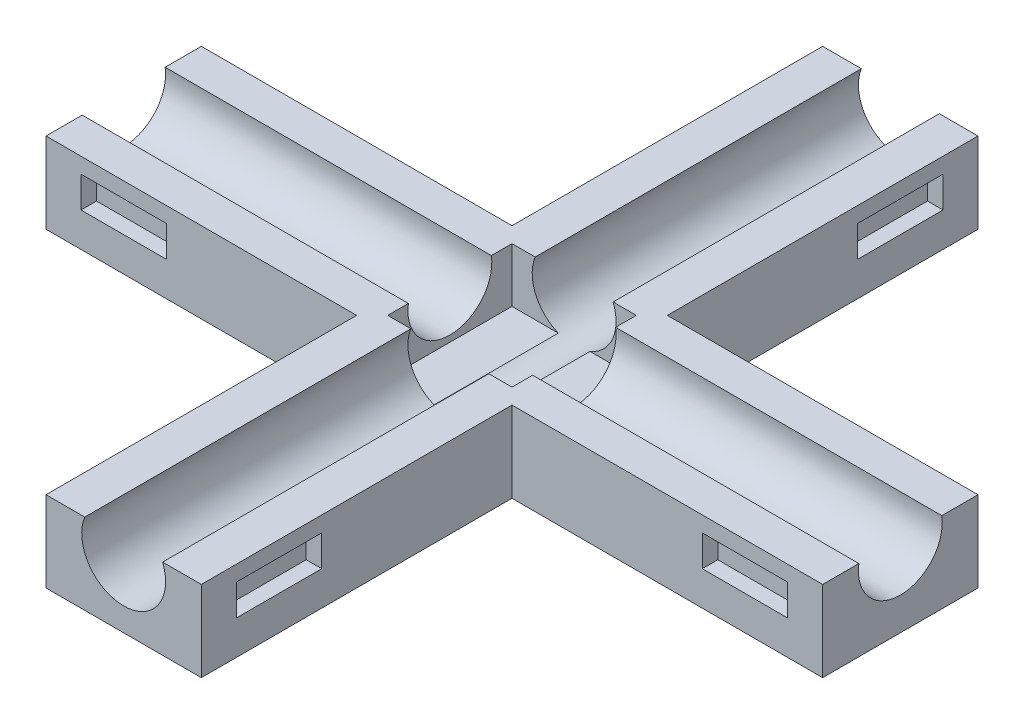
from build123d import *

# Parameters (mm, degrees)
BOSS_EXTRUDE5_DEPTH         = 5.2
CUT_EXTRUDE1_REACH          = 58.143
SKETCH4_R                   = 2.7
SKETCH5_R                   = 2.7
CUT_EXTRUDE2_DEPTH          = 57.143031625
SKETCH6_W                   = 8
SKETCH6_H                   = 8
CUT_EXTRUDE3_DEPTH          = 3.5
SKETCH7_W                   = 5.5
SKETCH7_H                   = 2
CUT_EXTRUDE4_DEPTH          = 1
CIRPATTERN1_COPY_1_SKETCH_W = 5.5
CIRPATTERN1_COPY_1_SKETCH_H = 2
CIRPATTERN1_COPY_1_DEPTH    = 1
CIRPATTERN1_COPY_2_SKETCH_W = 5.5
CIRPATTERN1_COPY_2_SKETCH_H = 2
CIRPATTERN1_COPY_2_DEPTH    = 1
CIRPATTERN1_COPY_3_SKETCH_W = 5.5
CIRPATTERN1_COPY_3_SKETCH_H = 2
CIRPATTERN1_COPY_3_DEPTH    = 1
CIRPATTERN1_COPY_4_SKETCH_W = 5.5
CIRPATTERN1_COPY_4_SKETCH_H = 2
CIRPATTERN1_COPY_4_DEPTH    = 1
CIRPATTERN1_COPY_5_SKETCH_W = 5.5
CIRPATTERN1_COPY_5_SKETCH_H = 2
CIRPATTERN1_COPY_5_DEPTH    = 1
CIRPATTERN1_COPY_6_SKETCH_W = 5.5
CIRPATTERN1_COPY_6_SKETCH_H = 2
CIRPATTERN1_COPY_6_DEPTH    = 1


with BuildPart() as part:
    # Sketch3 → Boss-Extrude5 (new body)
    with BuildSketch(Plane(origin=(0, 0, 0), x_dir=(1, 0, 0), z_dir=(0, 1, 0))):
        Polygon((5, 5), (25, 5), (25, -5), (5, -5), (5, -25), (-5, -25), (-5, -5), (-25, -5), (-25, 5), (-5, 5), (-5, 25), (5, 25), align=None)
    extrude(amount=BOSS_EXTRUDE5_DEPTH)

    # Sketch4 → Cut-Extrude1 (cut, up to next)
    with BuildSketch(Plane.XY.offset(25), mode=Mode.PRIVATE) as cut_extrude1_sk1:
        with Locations((0, 4.2)):
            Circle(SKETCH4_R)
    cut_extrude1_tool1 = extrude(cut_extrude1_sk1.sketch, amount=-CUT_EXTRUDE1_REACH, mode=Mode.PRIVATE) & part.part
    add(cut_extrude1_tool1.solids().sort_by_distance((0, 4.2, 25))[0], mode=Mode.SUBTRACT)

    # Sketch5 → Cut-Extrude2 (cut, through all)
    with BuildSketch(Plane(origin=(25, 0, 0), x_dir=(0, 0, -1), z_dir=(1, 0, 0))):
        with Locations((0, 4.8)):
            Circle(SKETCH5_R)
    extrude(amount=-CUT_EXTRUDE2_DEPTH, mode=Mode.SUBTRACT)

    # Sketch6 → Cut-Extrude3 (cut)
    with BuildSketch(Plane(origin=(0, 5.2, 0), x_dir=(1, 0, 0), z_dir=(0, 1, 0))):
        Rectangle(SKETCH6_W, SKETCH6_H)
    extrude(amount=-CUT_EXTRUDE3_DEPTH, mode=Mode.SUBTRACT)

    # Sketch7 → Cut-Extrude4 (cut)
    with BuildSketch(Plane.XY.offset(5)):
        with Locations((20, 3.2)):
            Rectangle(SKETCH7_W, SKETCH7_H)
    cut_extrude4 = extrude(amount=-CUT_EXTRUDE4_DEPTH, mode=Mode.SUBTRACT)

    # Mirror1: Cut-Extrude4 across plane
    add(cut_extrude4.mirror(Plane.XY), mode=Mode.SUBTRACT)

    # CirPattern1 copy 1 sketch → CirPattern1 copy 1 (cut)
    with BuildSketch(Plane(origin=(5, 0, 0), x_dir=(0, 0, 1), z_dir=(1, 0, 0))):
        with Locations((20, -3.2)):
            Rectangle(CIRPATTERN1_COPY_1_SKETCH_W, CIRPATTERN1_COPY_1_SKETCH_H)
    extrude(amount=-CIRPATTERN1_COPY_1_DEPTH, mode=Mode.SUBTRACT)

    # CirPattern1 copy 2 sketch → CirPattern1 copy 2 (cut)
    with BuildSketch(Plane(origin=(0, 0, 5), x_dir=(-1, 0, 0), z_dir=(0, 0, 1))):
        with Locations((20, -3.2)):
            Rectangle(CIRPATTERN1_COPY_2_SKETCH_W, CIRPATTERN1_COPY_2_SKETCH_H)
    extrude(amount=-CIRPATTERN1_COPY_2_DEPTH, mode=Mode.SUBTRACT)

    # CirPattern1 copy 3 sketch → CirPattern1 copy 3 (cut)
    with BuildSketch(Plane(origin=(-5, 0, 0), x_dir=(0, 0, -1), z_dir=(-1, 0, 0))):
        with Locations((20, -3.2)):
            Rectangle(CIRPATTERN1_COPY_3_SKETCH_W, CIRPATTERN1_COPY_3_SKETCH_H)
    extrude(amount=-CIRPATTERN1_COPY_3_DEPTH, mode=Mode.SUBTRACT)

    # CirPattern1 copy 4 sketch → CirPattern1 copy 4 (cut)
    with BuildSketch(Plane.ZY.offset(5)):
        with Locations((20, 3.2)):
            Rectangle(CIRPATTERN1_COPY_4_SKETCH_W, CIRPATTERN1_COPY_4_SKETCH_H)
    extrude(amount=-CIRPATTERN1_COPY_4_DEPTH, mode=Mode.SUBTRACT)

    # CirPattern1 copy 5 sketch → CirPattern1 copy 5 (cut)
    with BuildSketch(Plane(origin=(0, 0, -5), x_dir=(-1, 0, 0), z_dir=(0, 0, -1))):
        with Locations((20, 3.2)):
            Rectangle(CIRPATTERN1_COPY_5_SKETCH_W, CIRPATTERN1_COPY_5_SKETCH_H)
    extrude(amount=-CIRPATTERN1_COPY_5_DEPTH, mode=Mode.SUBTRACT)

    # CirPattern1 copy 6 sketch → CirPattern1 copy 6 (cut)
    with BuildSketch(Plane(origin=(5, 0, 0), x_dir=(0, 0, -1), z_dir=(1, 0, 0))):
        with Locations((20, 3.2)):
            Rectangle(CIRPATTERN1_COPY_6_SKETCH_W, CIRPATTERN1_COPY_6_SKETCH_H)
    extrude(amount=-CIRPATTERN1_COPY_6_DEPTH, mode=Mode.SUBTRACT)


solid = part.part
